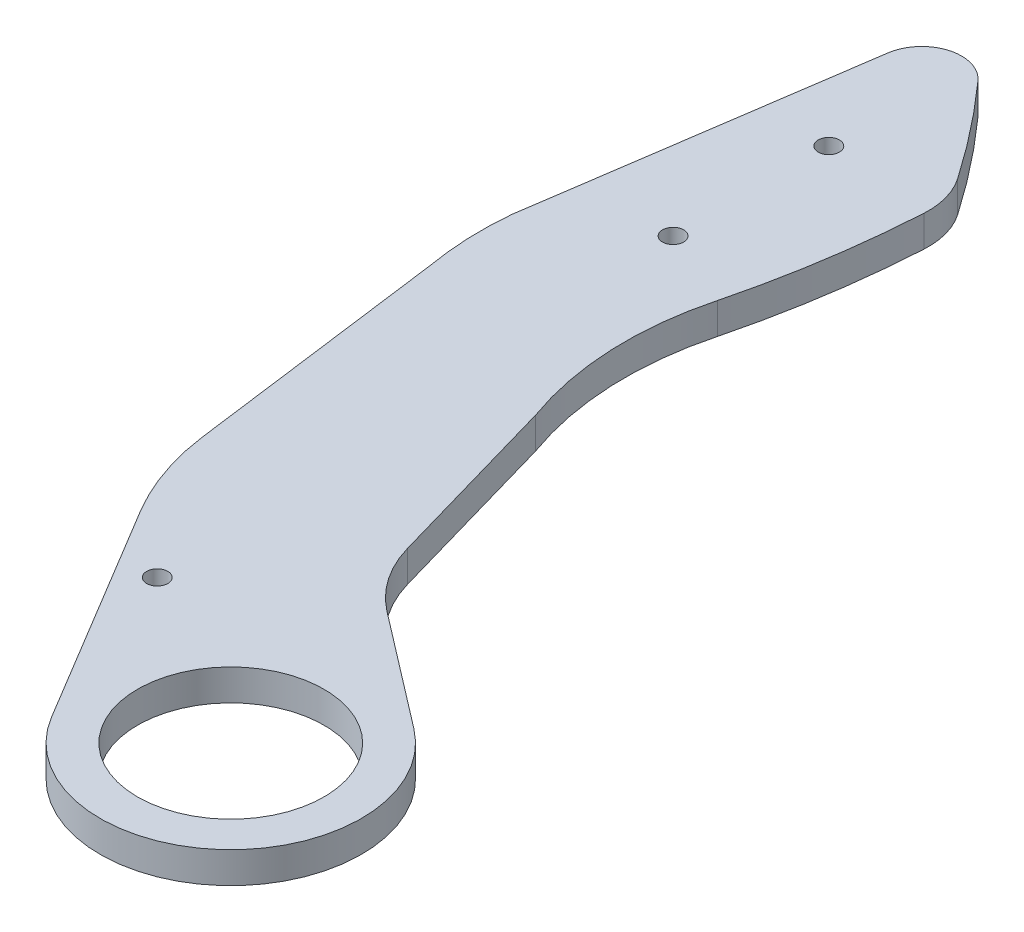
from build123d import *

# Parameters (mm, degrees)
SKETCH1_R           = 14.975
SKETCH1_R_2         = 1.7
BOSS_EXTRUDE2_DEPTH = 5
CUT_EXTRUDE1_REACH  = 164.524
SKETCH3_R           = 1.7


with BuildPart() as part:
    # Sketch1 → Boss-Extrude2 (new body)
    with BuildSketch(Plane(origin=(0, 0, 0), x_dir=(1, 0, 0), z_dir=(0, 1, 0))):
        with BuildLine():
            Line((12.756485957, 16.650005737), (-5.812603326, 30.876807241))
            ThreePointArc((-5.812603326, 30.876807241), (-10.178871966, 35.493803021), (-12.876419651, 41.247426954))
            Line((-12.876419651, 41.247426954), (-21.13456265, 70.088423369))
            ThreePointArc((-21.13456265, 70.088423369), (-24.125041887, 85.243134658), (-22.456551163, 100.599709115))
            ThreePointArc((-22.456551163, 100.599709115), (-19.558480324, 114.843106453), (-18.020623668, 129.29676271))
            ThreePointArc((-18.020623668, 129.29676271), (-18.441772746, 133.226047543), (-20.116399197, 136.805470974))
            ThreePointArc((-20.116399197, 136.805470974), (-25.866377757, 144.615905974), (-32.098124488, 152.047627243))
            ThreePointArc((-32.098124488, 152.047627243), (-38.706331156, 153.910886754), (-43.194615771, 148.715173848))
            Line((-43.194615771, 148.715173848), (-50.932711484, 96.056215067))
            ThreePointArc((-50.932711484, 96.056215067), (-51.118515181, 89.191813761), (-50.383474997, 82.364351257))
            Line((-50.383474997, 82.364351257), (-44.824720745, 40.290812443))
            ThreePointArc((-44.824720745, 40.290812443), (-42.928869469, 32.33094735), (-39.452930017, 24.92341407))
            Line((-39.452930017, 24.92341407), (-17.977463078, -10.80562105))
            ThreePointArc((-17.977463078, -10.80562105), (13.973815194, -15.642350012), (12.756485957, 16.650005737))
        make_face()
        with Locations(Location((0, 0, 0), (0, 0, 270))):
            Circle(SKETCH1_R, mode=Mode.SUBTRACT)
        with Locations(Location((-28.930848813, 17.123276905, 0), (0, 0, 270))):
            Circle(SKETCH1_R_2, mode=Mode.SUBTRACT)
    extrude(amount=BOSS_EXTRUDE2_DEPTH)

    # Sketch3 → Cut-Extrude1 (cut, up to next)
    with BuildSketch(Plane(origin=(0, 5, 0), x_dir=(1, 0, 0), z_dir=(0, 1, 0)), mode=Mode.PRIVATE) as cut_extrude1_sk1:
        with Locations(Location((-35, 131, 0), (0, 0, 270))):
            Circle(SKETCH3_R)
    cut_extrude1_tool1 = extrude(cut_extrude1_sk1.sketch, amount=-CUT_EXTRUDE1_REACH, mode=Mode.PRIVATE) & part.part
    # Sketch3 → Cut-Extrude1 (cut, up to next)
    with BuildSketch(Plane(origin=(0, 5, 0), x_dir=(1, 0, 0), z_dir=(0, 1, 0)), mode=Mode.PRIVATE) as cut_extrude1_sk2:
        with Locations(Location((-35, 106, 0), (0, 0, 270))):
            Circle(SKETCH3_R)
    cut_extrude1_tool2 = extrude(cut_extrude1_sk2.sketch, amount=-CUT_EXTRUDE1_REACH, mode=Mode.PRIVATE) & part.part
    add(cut_extrude1_tool1.solids().sort_by_distance((-35, 5, -131))[0], mode=Mode.SUBTRACT)
    add(cut_extrude1_tool2.solids().sort_by_distance((-35, 5, -106))[0], mode=Mode.SUBTRACT)


solid = part.part
